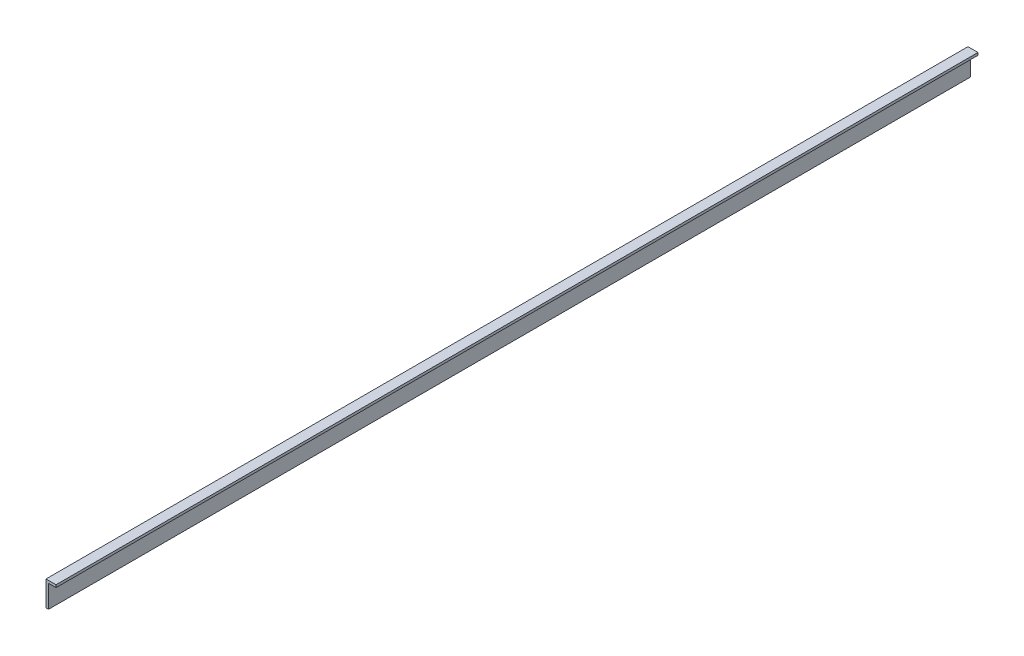
from build123d import *

# Parameters (mm, degrees)
STORE_KASET_L_RAF_2_SOL_1_START = -20
STORE_KASET_L_RAF_2_SOL_1_DEPTH = 735.5


with BuildPart() as part:
    # Sketch1 → STORE_kaset_L_raf_2_sol_1 (new body)
    with BuildSketch(Plane.XY.offset(STORE_KASET_L_RAF_2_SOL_1_START)):
        Polygon((245.5, 404.5), (243.5, 404.5), (243.5, 424.5), (251.5, 424.5), (251.5, 422.5), (245.5, 422.5), align=None)
    extrude(amount=-STORE_KASET_L_RAF_2_SOL_1_DEPTH)


solid = part.part
